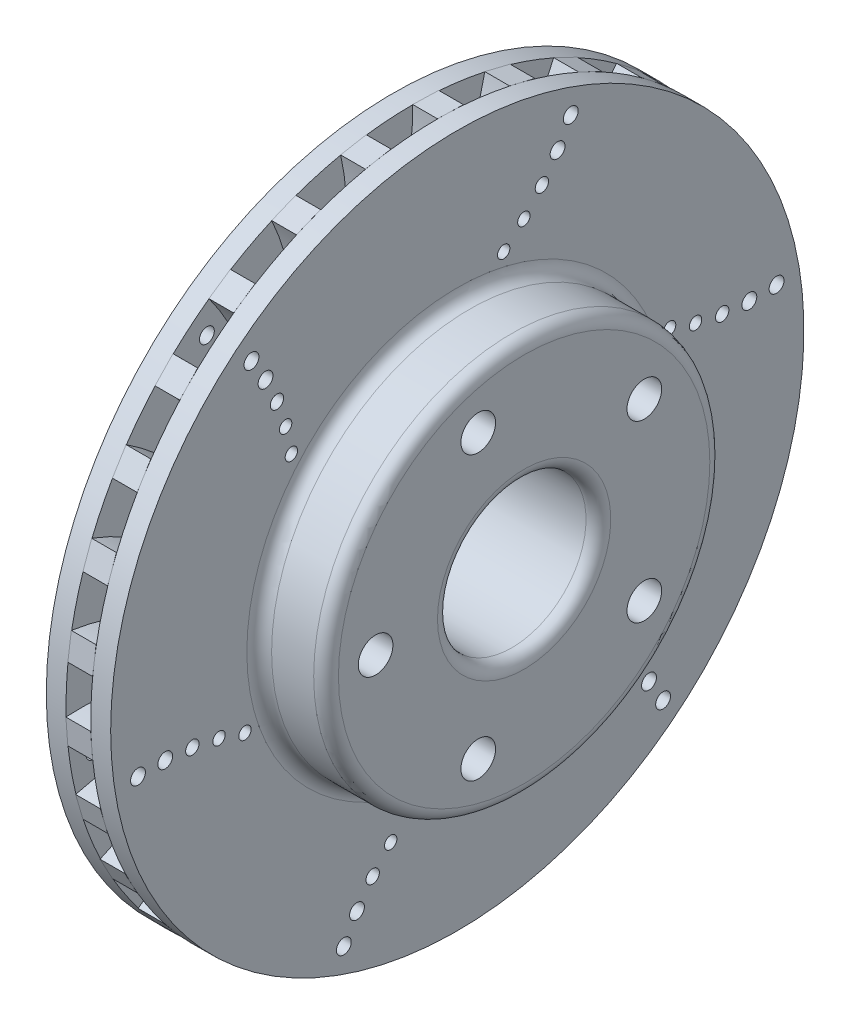
from build123d import *

# Parameters (mm, degrees)
BOSS_EXTRUDE1_DEPTH            = 10
CIRPATTERN1_COUNT              = 30
CUT_EXTRUDE1_REACH             = 215.636
SKETCH4_R                      = 7
CUT_EXTRUDE1_DIRECTION_2_DEPTH = 214.63554595
SKETCH6_R                      = 3
SKETCH6_R_2                    = 2.5
SKETCH6_R_3                    = 2.7
CUT_EXTRUDE4_DEPTH             = 50


with BuildPart() as part:
    # Sketch1 → Revolve1 (revolve)
    with BuildSketch(Plane.XY, mode=Mode.PRIVATE) as revolve1_sk:
        with BuildLine():
            Line((13, 140), (13, 85))
            ThreePointArc((13, 85), (14.464466094, 81.464466094), (18, 80))
            Line((18, 80), (35, 80))
            ThreePointArc((35, 80), (38.535533906, 78.535533906), (40, 75))
            Line((40, 75), (40, 35))
            ThreePointArc((40, 35), (38.535533906, 31.464466094), (35, 30))
            Line((35, 30), (-35, 30))
            ThreePointArc((-35, 30), (-38.535533906, 31.464466094), (-40, 35))
            Line((-40, 35), (-40, 75))
            ThreePointArc((-40, 75), (-38.535533906, 78.535533906), (-35, 80))
            Line((-35, 80), (-18, 80))
            ThreePointArc((-18, 80), (-14.464466094, 81.464466094), (-13, 85))
            Line((-13, 85), (-13, 140))
            Line((-13, 140), (-5, 140))
            Line((-5, 140), (-5, 55))
            ThreePointArc((-5, 55), (-6.464466094, 51.464466094), (-10, 50))
            Line((-10, 50), (-25, 50))
            ThreePointArc((-25, 50), (-28.535533906, 48.535533906), (-30, 45))
            Line((-30, 45), (-30, 40))
            ThreePointArc((-30, 40), (-28.535533906, 36.464466094), (-25, 35))
            Line((-25, 35), (15, 35))
            ThreePointArc((15, 35), (18.535533906, 36.464466094), (20, 40))
            Line((20, 40), (20, 50))
            ThreePointArc((20, 50), (18.535533906, 53.535533906), (15, 55))
            Line((15, 55), (5, 55))
            Line((5, 55), (5, 140))
            Line((5, 140), (13, 140))
        make_face()
    revolve(revolve1_sk.sketch.rotate(Axis((-87.208333333, 0, 0), (1, 0, 0)), 90), axis=Axis((-87.208333333, 0, 0), (1, 0, 0)))

    # Sketch3 → Boss-Extrude1 (add)
    with BuildSketch(Plane(origin=(-5, 0, 0), x_dir=(0, 0, -1), z_dir=(1, 0, 0))):
        with BuildLine():
            Line((-0.000774849, 140.062187673), (10.499225151, 139.749248462))
            ThreePointArc((10.499225151, 139.749248462), (3.423085342, 107.196144199), (-13.953427537, 78.77373839))
            Line((-13.953427537, 78.77373839), (-21.268173939, 77.121104617))
            ThreePointArc((-21.268173939, 77.121104617), (-5.254701729, 106.773854542), (-0.000774849, 140.062187673))
        make_face()
    boss_extrude1 = extrude(amount=BOSS_EXTRUDE1_DEPTH)

    # CirPattern1: Boss-Extrude1 ×30 about axis
    cirpattern1_axis = Axis((0, 0, 0), (1, 0, 0))
    for i in range(1, CIRPATTERN1_COUNT):
        add(boss_extrude1.rotate(cirpattern1_axis, i * 360 / CIRPATTERN1_COUNT))

    # Cut-Extrude1: up to this face of the body (flat: up to its plane)
    cut_extrude1_end = Plane(part.part.faces().sort_by_distance((40, 0, -72.878679656))[0])
    # Sketch4 → Cut-Extrude1 (cut, up to the picked face)
    with BuildSketch(Plane.ZY.offset(40), mode=Mode.PRIVATE) as cut_extrude1_sk1:
        with Locations((60, 0)):
            Circle(SKETCH4_R)
    cut_extrude1_tool1 = split(extrude(cut_extrude1_sk1.sketch, amount=-CUT_EXTRUDE1_REACH, mode=Mode.PRIVATE), bisect_by=cut_extrude1_end, keep=Keep.BOTH, mode=Mode.PRIVATE)
    # Sketch4 → Cut-Extrude1 (cut, up to the picked face)
    with BuildSketch(Plane.ZY.offset(40), mode=Mode.PRIVATE) as cut_extrude1_sk2:
        with Locations((18.541019662, -57.063390978)):
            Circle(SKETCH4_R)
    cut_extrude1_tool2 = split(extrude(cut_extrude1_sk2.sketch, amount=-CUT_EXTRUDE1_REACH, mode=Mode.PRIVATE), bisect_by=cut_extrude1_end, keep=Keep.BOTH, mode=Mode.PRIVATE)
    # Sketch4 → Cut-Extrude1 (cut, up to the picked face)
    with BuildSketch(Plane.ZY.offset(40), mode=Mode.PRIVATE) as cut_extrude1_sk3:
        with Locations((-48.541019662, -35.267115138)):
            Circle(SKETCH4_R)
    cut_extrude1_tool3 = split(extrude(cut_extrude1_sk3.sketch, amount=-CUT_EXTRUDE1_REACH, mode=Mode.PRIVATE), bisect_by=cut_extrude1_end, keep=Keep.BOTH, mode=Mode.PRIVATE)
    # Sketch4 → Cut-Extrude1 (cut, up to the picked face)
    with BuildSketch(Plane.ZY.offset(40), mode=Mode.PRIVATE) as cut_extrude1_sk4:
        with Locations((-48.541019662, 35.267115138)):
            Circle(SKETCH4_R)
    cut_extrude1_tool4 = split(extrude(cut_extrude1_sk4.sketch, amount=-CUT_EXTRUDE1_REACH, mode=Mode.PRIVATE), bisect_by=cut_extrude1_end, keep=Keep.BOTH, mode=Mode.PRIVATE)
    # Sketch4 → Cut-Extrude1 (cut, up to the picked face)
    with BuildSketch(Plane.ZY.offset(40), mode=Mode.PRIVATE) as cut_extrude1_sk5:
        with Locations((18.541019662, 57.063390978)):
            Circle(SKETCH4_R)
    cut_extrude1_tool5 = split(extrude(cut_extrude1_sk5.sketch, amount=-CUT_EXTRUDE1_REACH, mode=Mode.PRIVATE), bisect_by=cut_extrude1_end, keep=Keep.BOTH, mode=Mode.PRIVATE)
    add(cut_extrude1_tool1.solids().sort_by(Axis((-40, 0, 60), (1, 0, 0)))[0], mode=Mode.SUBTRACT)
    add(cut_extrude1_tool2.solids().sort_by(Axis((-40, -57.063391, 18.54102), (1, 0, 0)))[0], mode=Mode.SUBTRACT)
    add(cut_extrude1_tool3.solids().sort_by(Axis((-40, -35.267115, -48.54102), (1, 0, 0)))[0], mode=Mode.SUBTRACT)
    add(cut_extrude1_tool4.solids().sort_by(Axis((-40, 35.267115, -48.54102), (1, 0, 0)))[0], mode=Mode.SUBTRACT)
    add(cut_extrude1_tool5.solids().sort_by(Axis((-40, 57.063391, 18.54102), (1, 0, 0)))[0], mode=Mode.SUBTRACT)

    # Sketch4 → Cut-Extrude1 direction 2 (cut)
    with BuildSketch(Plane.ZY.offset(40)):
        with Locations((60, 0)):
            Circle(SKETCH4_R)
        with Locations((18.541019662, -57.063390978)):
            Circle(SKETCH4_R)
        with Locations((-48.541019662, -35.267115138)):
            Circle(SKETCH4_R)
        with Locations((-48.541019662, 35.267115138)):
            Circle(SKETCH4_R)
        with Locations((18.541019662, 57.063390978)):
            Circle(SKETCH4_R)
    extrude(amount=CUT_EXTRUDE1_DIRECTION_2_DEPTH, mode=Mode.SUBTRACT)

    # Sketch6 → Cut-Extrude4 (cut)
    with BuildSketch(Plane.ZY.offset(13)):
        with Locations((-45.824873918, 122.449886397)):
            Circle(SKETCH6_R)
        with Locations((-18.744227927, 88.193527524)):
            Circle(SKETCH6_R_2)
        with Locations((-26.891268968, 95.584449136)):
            Circle(SKETCH6_R_2)
        with Locations((-34.177249629, 103.825473697)):
            Circle(SKETCH6_R_3)
        with Locations((-40.514009544, 112.816884809)):
            Circle(SKETCH6_R)
        with Locations((67.005721322, 60.329741321)):
            Circle(SKETCH6_R_2)
        with Locations((69.332926675, 71.080746634)):
            Circle(SKETCH6_R_2)
        with Locations((72.826872967, 81.511103258)):
            Circle(SKETCH6_R_3)
        with Locations((83.132275351, 100.910448137)):
            Circle(SKETCH6_R)
        with Locations((77.445283448, 91.494603879)):
            Circle(SKETCH6_R)
        with Locations((85.749949249, -27.863786203)):
            Circle(SKETCH6_R_2)
        with Locations((96.224195643, -24.503702502)):
            Circle(SKETCH6_R_2)
        with Locations((107.004122596, -22.314370439)):
            Circle(SKETCH6_R_3)
        with Locations((128.957149269, -21.53943826)):
            Circle(SKETCH6_R)
        with Locations((117.959292992, -21.32228093)):
            Circle(SKETCH6_R)
        with Locations((18.744227927, -88.193527524)):
            Circle(SKETCH6_R_2)
        with Locations((26.891268968, -95.584449136)):
            Circle(SKETCH6_R_2)
        with Locations((34.177249629, -103.825473697)):
            Circle(SKETCH6_R_3)
        with Locations((45.824873918, -122.449886397)):
            Circle(SKETCH6_R)
        with Locations((40.514009544, -112.816884809)):
            Circle(SKETCH6_R)
        with Locations((-67.005721322, -60.329741321)):
            Circle(SKETCH6_R_2)
        with Locations((-69.332926675, -71.080746634)):
            Circle(SKETCH6_R_2)
        with Locations((-72.826872967, -81.511103258)):
            Circle(SKETCH6_R_3)
        with Locations((-83.132275351, -100.910448137)):
            Circle(SKETCH6_R)
        with Locations((-77.445283448, -91.494603879)):
            Circle(SKETCH6_R)
        with Locations((-85.749949249, 27.863786203)):
            Circle(SKETCH6_R_2)
        with Locations((-96.224195643, 24.503702502)):
            Circle(SKETCH6_R_2)
        with Locations((-107.004122596, 22.314370439)):
            Circle(SKETCH6_R_3)
        with Locations((-128.957149269, 21.53943826)):
            Circle(SKETCH6_R)
        with Locations((-117.959292992, 21.32228093)):
            Circle(SKETCH6_R)
    extrude(amount=-CUT_EXTRUDE4_DEPTH, mode=Mode.SUBTRACT)


solid = part.part
